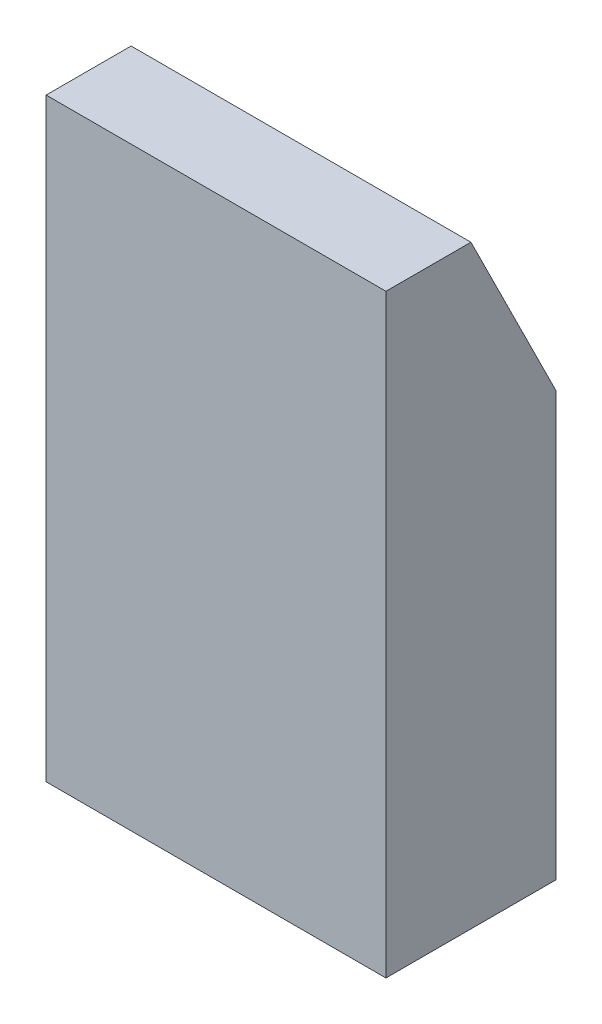
from build123d import *

# Parameters (mm, degrees)
SKETCH1_W           = 40
SKETCH1_H           = 20
BOSS_EXTRUDE1_DEPTH = 70
CUT_EXTRUDE1_DEPTH  = 40


with BuildPart() as part:
    # Sketch1 → Boss-Extrude1 (new body)
    with BuildSketch(Plane(origin=(0, 0, 0), x_dir=(1, 0, 0), z_dir=(0, 1, 0))):
        with Locations((20, 10)):
            Rectangle(SKETCH1_W, SKETCH1_H)
    extrude(amount=BOSS_EXTRUDE1_DEPTH)

    # Sketch2 → Cut-Extrude1 (cut)
    with BuildSketch(Plane(origin=(0, 0, 0), x_dir=(0, 0, -1), z_dir=(1, 0, 0))):
        Polygon((10, 70), (20, 49.892008703), (27.740621585, 66.282102968), (20, 74.973147169), align=None)
    extrude(amount=CUT_EXTRUDE1_DEPTH, mode=Mode.SUBTRACT)


solid = part.part
